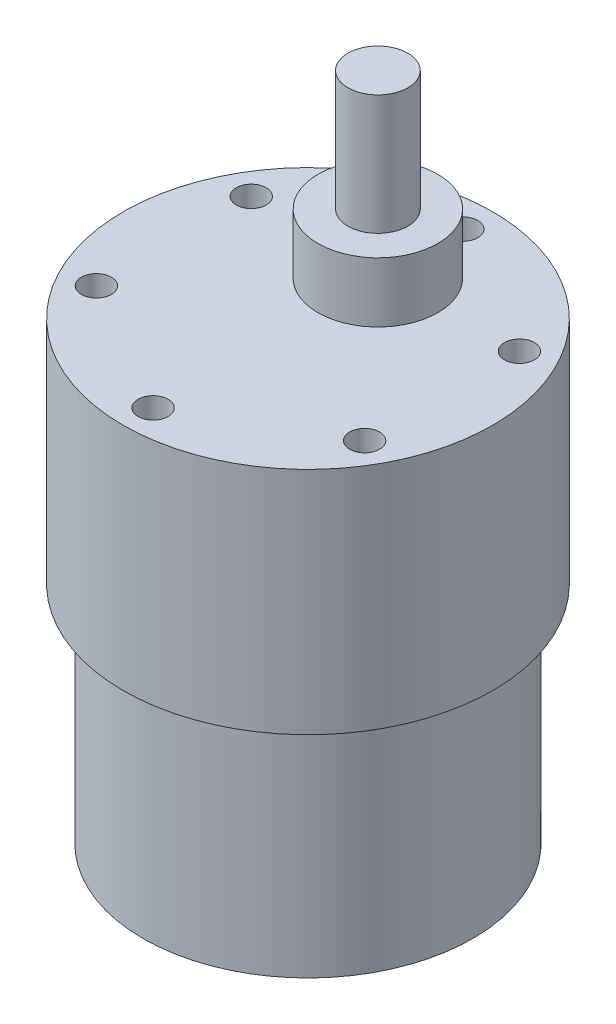
from build123d import *

# Parameters (mm, degrees)
SKETCH_1_R          = 18.5
EXTRUDE_1_DEPTH     = 23
SKETCH_3_R          = 16.5
EXTRUDE_2_DEPTH     = 22.5
SKETCH_4_R          = 1.5
CUT_EXTRUDE_1_DEPTH = 15
SKETCH_5_R          = 6
EXTRUDE_3_DEPTH     = 6
SKETCH_6_R          = 3
EXTRUDE_4_DEPTH     = 12


with BuildPart() as part:
    # 草图1 → 凸台-拉伸1 (new body)
    with BuildSketch(Plane(origin=(0, 0, 0), x_dir=(1, 0, 0), z_dir=(0, 1, 0))):
        with Locations(Location((0, 0, 0), (0, 0, 270))):
            Circle(SKETCH_1_R)
    extrude(amount=-EXTRUDE_1_DEPTH)

    # 草图3 → 凸台-拉伸2 (add)
    with BuildSketch(Plane.XZ.offset(23)):
        with Locations(Location((0, 0, 0), (0, 0, 90))):
            Circle(SKETCH_3_R)
    extrude(amount=EXTRUDE_2_DEPTH)

    # 草图4 → 切除-拉伸1 (cut)
    with BuildSketch(Plane(origin=(0, 0, 0), x_dir=(1, 0, 0), z_dir=(0, 1, 0))):
        with Locations(Location((0, 15.5, 0), (0, 0, 270))):
            Circle(SKETCH_4_R)
        with Locations(Location((13.423393759, 7.75, 0), (0, 0, 270))):
            Circle(SKETCH_4_R)
        with Locations(Location((13.423393759, -7.75, 0), (0, 0, 270))):
            Circle(SKETCH_4_R)
        with Locations(Location((0, -15.5, 0), (0, 0, 270))):
            Circle(SKETCH_4_R)
        with Locations(Location((-13.423393759, -7.75, 0), (0, 0, 270))):
            Circle(SKETCH_4_R)
        with Locations(Location((-13.423393759, 7.75, 0), (0, 0, 270))):
            Circle(SKETCH_4_R)
    extrude(amount=-CUT_EXTRUDE_1_DEPTH, mode=Mode.SUBTRACT)

    # 草图5 → 凸台-拉伸3 (add)
    with BuildSketch(Plane(origin=(0, 0, 0), x_dir=(1, 0, 0), z_dir=(0, 1, 0))):
        with Locations(Location((0, 7, 0), (0, 0, 270))):
            Circle(SKETCH_5_R)
    extrude(amount=EXTRUDE_3_DEPTH)

    # 草图6 → 凸台-拉伸4 (add)
    with BuildSketch(Plane(origin=(0, 6, 0), x_dir=(1, 0, 0), z_dir=(0, 1, 0))):
        with Locations(Location((0, 7, 0), (0, 0, 270))):
            Circle(SKETCH_6_R)
    extrude(amount=EXTRUDE_4_DEPTH)


solid = part.part
